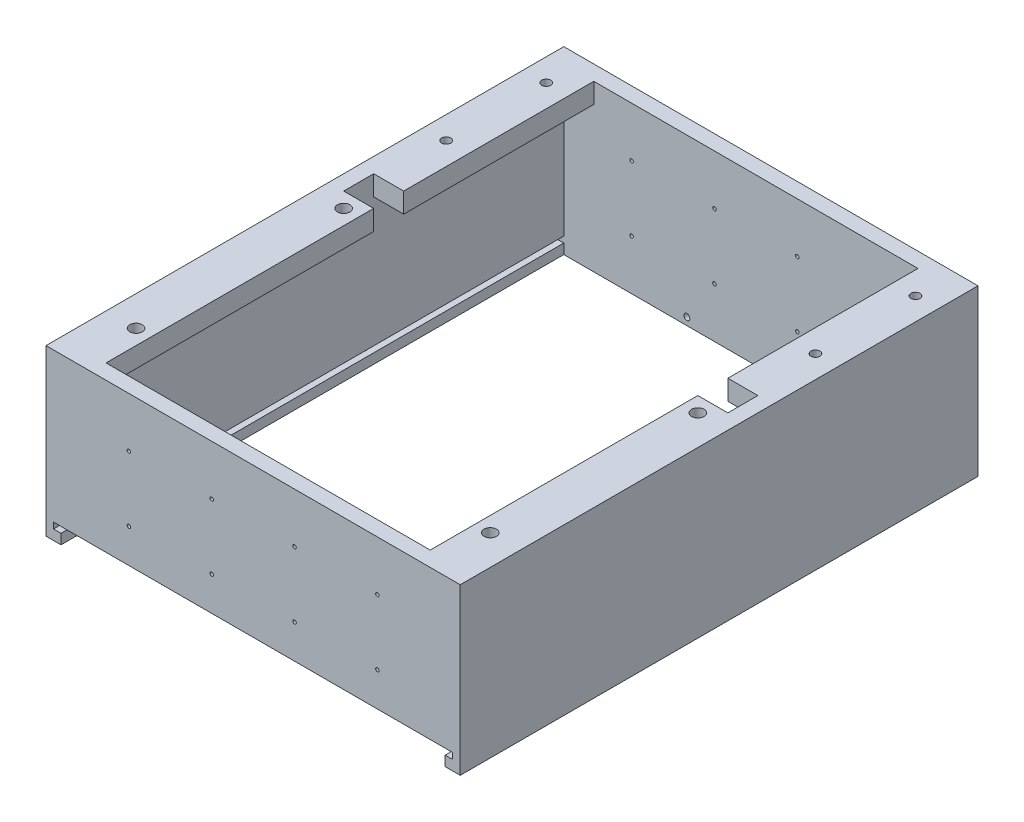
from build123d import *

# Parameters (mm, degrees)
SKETCH_1_W           = 6
SKETCH_1_H           = 56.5
SKETCH_1_R           = 1.25
EXTRUDE_1_DEPTH      = 4
SKETCH_1_H_2         = 41
EXTRUDE_1_2_DEPTH    = 4
SKETCH_3_W           = 3
SKETCH_3_H           = 103.5
EXTRUDE_2_DEPTH      = 33
SKETCH_1_5_R         = 2
CUT_EXTRUDE_1_DEPTH  = 1.5
EXTRUDE_3_REACH      = 90.366
SKETCH_4_W           = 82.8
SKETCH_4_H           = 3
SKETCH_5_W           = 76.8
SKETCH_5_H           = 3
CUT_EXTRUDE_2_DEPTH  = 3.2
SKETCH_7_W           = 79.8
SKETCH_7_H           = 1.2
CUT_EXTRUDE_4_DEPTH  = 113.495377683
SKETCH_8_R           = 0.9
CUT_EXTRUDE_5_DEPTH  = 89.365844646
SKETCH_9_R           = 0.6
CUT_EXTRUDE_6_DEPTH  = 116.183375537
SKETCH_9_3_R         = 1
CUT_EXTRUDE_7_DEPTH  = 1.5
SKETCH_10_R          = 0.35
CUT_EXTRUDE_8_DEPTH  = 3
SKETCH_11_R          = 0.35
CUT_EXTRUDE_9_DEPTH  = 3
SKETCH_12_R          = 0.35
CUT_EXTRUDE_10_DEPTH = 116.183375537


with BuildPart() as part:
    # 草图1 → 凸台-拉伸1 (new body)
    with BuildSketch(Plane(origin=(0, 0, 0), x_dir=(1, 0, 0), z_dir=(0, 1, 0))):
        with Locations((-35.4, -4.5)):
            Rectangle(SKETCH_1_W, SKETCH_1_H)
        with Locations(Location((-35.4, 20.75, 0), (0, 0, 270))):
            Circle(SKETCH_1_R, mode=Mode.SUBTRACT)
        with Locations(Location((-35.4, -20.75, 0), (0, 0, 270))):
            Circle(SKETCH_1_R, mode=Mode.SUBTRACT)
    extrude(amount=EXTRUDE_1_DEPTH)



with BuildPart() as body_2:
    # 草图1 → Extrude 1 2 (new body)
    with BuildSketch(Plane(origin=(0, 0, 0), x_dir=(1, 0, 0), z_dir=(0, 1, 0))):
        with Locations((-35.4, 50.25)):
            Rectangle(SKETCH_1_W, SKETCH_1_H_2)
    extrude(amount=EXTRUDE_1_2_DEPTH)


with BuildPart() as part_1:
    add(part.part)

    add(body_2.part)  # 凸台-拉伸2 merges body 2
    # 草图3 → 凸台-拉伸2 (add)
    with BuildSketch(Plane(origin=(0, 4, 0), x_dir=(1, 0, 0), z_dir=(0, 1, 0))):
        with Locations((-39.9, 19)):
            Rectangle(SKETCH_3_W, SKETCH_3_H)
    extrude(amount=-EXTRUDE_2_DEPTH)

    # 草图1<5> → 切除-拉伸1 (cut)
    with BuildSketch(Plane(origin=(0, 0, 0), x_dir=(1, 0, 0), z_dir=(0, 1, 0))):
        with Locations(Location((-35.4, 20.75, 0), (0, 0, 270))):
            Circle(SKETCH_1_5_R)
        with Locations(Location((-35.4, -20.75, 0), (0, 0, 270))):
            Circle(SKETCH_1_5_R)
    extrude(amount=CUT_EXTRUDE_1_DEPTH, mode=Mode.SUBTRACT)


with BuildPart() as body_2_2:
    # 镜向3: mirrored copy
    add(part_1.part.mirror(Plane(origin=(0, 0, 0), x_dir=(0, 0, 1), z_dir=(1, 0, 0))))

    # 凸台-拉伸3: up to this face of the body (flat: up to its plane)
    extrude_3_end = Plane(body_2_2.part.faces().sort_by_distance((39.9, -29, -19))[0])
    # 草图4 → 凸台-拉伸3 (add, up to the picked face)
    with BuildSketch(Plane.XZ.offset(-4), mode=Mode.PRIVATE) as extrude_3_sk1:
        with Locations((0, 31.25)):
            Rectangle(SKETCH_4_W, SKETCH_4_H)
    extrude_3_tool1 = split(extrude(extrude_3_sk1.sketch, amount=EXTRUDE_3_REACH, mode=Mode.PRIVATE), bisect_by=extrude_3_end, keep=Keep.BOTH, mode=Mode.PRIVATE)
    # 草图4 → 凸台-拉伸3 (add, up to the picked face)
    with BuildSketch(Plane.XZ.offset(-4), mode=Mode.PRIVATE) as extrude_3_sk2:
        with Locations((0, -69.25)):
            Rectangle(SKETCH_4_W, SKETCH_4_H)
    extrude_3_tool2 = split(extrude(extrude_3_sk2.sketch, amount=EXTRUDE_3_REACH, mode=Mode.PRIVATE), bisect_by=extrude_3_end, keep=Keep.BOTH, mode=Mode.PRIVATE)

    add(part_1.part)  # 凸台-拉伸3 merges part
    add(extrude_3_tool1.solids().sort_by(Axis((0, 4, 31.25), (0, -1, 0)))[0])
    add(extrude_3_tool2.solids().sort_by(Axis((0, 4, -69.25), (0, -1, 0)))[0])

    # 草图5 → 切除-拉伸2 (cut)
    with BuildSketch(Plane.XZ.offset(29)):
        with Locations((0, 31.25)):
            Rectangle(SKETCH_5_W, SKETCH_5_H)
    extrude(amount=-CUT_EXTRUDE_2_DEPTH, mode=Mode.SUBTRACT)

    # 草图7 → 切除-拉伸4 (cut, through all)
    with BuildSketch(Plane.XY.offset(-67.75)):
        with Locations((0, -26.4)):
            Rectangle(SKETCH_7_W, SKETCH_7_H)
    extrude(amount=CUT_EXTRUDE_4_DEPTH, mode=Mode.SUBTRACT)

    # 草图8 → 切除-拉伸5 (cut, through all)
    with BuildSketch(Plane(origin=(0, 4, 0), x_dir=(1, 0, 0), z_dir=(0, 1, 0))):
        with Locations(Location((36.9, 62.75, 0), (0, 0, 270))):
            Circle(SKETCH_8_R)
        with Locations(Location((-36.9, 62.75, 0), (0, 0, 270))):
            Circle(SKETCH_8_R)
        with Locations(Location((-36.9, 42.75, 0), (0, 0, 270))):
            Circle(SKETCH_8_R)
        with Locations(Location((36.9, 42.75, 0), (0, 0, 270))):
            Circle(SKETCH_8_R)
    extrude(amount=-CUT_EXTRUDE_5_DEPTH, mode=Mode.SUBTRACT)

    # 草图9 → 切除-拉伸6 (cut, through all)
    with BuildSketch(Plane(origin=(0, 0, -70.75), x_dir=(-1, 0, 0), z_dir=(0, 0, -1))):
        with Locations((13.8, -27.5)):
            Circle(SKETCH_9_R)
        with Locations((-13.8, -27.5)):
            Circle(SKETCH_9_R)
    extrude(amount=-CUT_EXTRUDE_6_DEPTH, mode=Mode.SUBTRACT)

    # 草图9<3> → 切除-拉伸7 (cut)
    with BuildSketch(Plane(origin=(0, 0, -70.75), x_dir=(-1, 0, 0), z_dir=(0, 0, -1))):
        with Locations((-13.8, -27.5)):
            Circle(SKETCH_9_3_R)
        with Locations((13.8, -27.5)):
            Circle(SKETCH_9_3_R)
    extrude(amount=-CUT_EXTRUDE_7_DEPTH, mode=Mode.SUBTRACT)

    # 草图10 → 切除-拉伸8 (cut)
    with BuildSketch(Plane.XZ.offset(25.8)):
        with Locations(Location((-13.8, 31.25, 0), (0, 0, 270))):
            Circle(SKETCH_10_R)
        with Locations(Location((13.8, 31.25, 0), (0, 0, 270))):
            Circle(SKETCH_10_R)
    extrude(amount=-CUT_EXTRUDE_8_DEPTH, mode=Mode.SUBTRACT)

    # 草图11 → 切除-拉伸9 (cut)
    with BuildSketch(Plane.XZ.offset(29)):
        with Locations(Location((39.9, 12.05, 0), (0, 0, 270))):
            Circle(SKETCH_11_R)
        with Locations(Location((39.9, -8.65, 0), (0, 0, 270))):
            Circle(SKETCH_11_R)
        with Locations(Location((39.9, -29.35, 0), (0, 0, 270))):
            Circle(SKETCH_11_R)
        with Locations(Location((39.9, -50.05, 0), (0, 0, 270))):
            Circle(SKETCH_11_R)
        with Locations(Location((-39.9, 12.05, 0), (0, 0, 270))):
            Circle(SKETCH_11_R)
        with Locations(Location((-39.9, -8.65, 0), (0, 0, 270))):
            Circle(SKETCH_11_R)
        with Locations(Location((-39.9, -29.35, 0), (0, 0, 270))):
            Circle(SKETCH_11_R)
        with Locations(Location((-39.9, -50.05, 0), (0, 0, 270))):
            Circle(SKETCH_11_R)
    extrude(amount=-CUT_EXTRUDE_9_DEPTH, mode=Mode.SUBTRACT)

    # 草图12 → 切除-拉伸10 (cut, through all)
    with BuildSketch(Plane(origin=(0, 0, -70.75), x_dir=(-1, 0, 0), z_dir=(0, 0, -1))):
        with Locations((-24.84, -6)):
            Circle(SKETCH_12_R)
        with Locations((-8.28, -6)):
            Circle(SKETCH_12_R)
        with Locations((8.28, -6)):
            Circle(SKETCH_12_R)
        with Locations((24.84, -6)):
            Circle(SKETCH_12_R)
        with Locations((-24.84, -19)):
            Circle(SKETCH_12_R)
        with Locations((-8.28, -19)):
            Circle(SKETCH_12_R)
        with Locations((8.28, -19)):
            Circle(SKETCH_12_R)
        with Locations((24.84, -19)):
            Circle(SKETCH_12_R)
    extrude(amount=-CUT_EXTRUDE_10_DEPTH, mode=Mode.SUBTRACT)


solid = body_2_2.part
